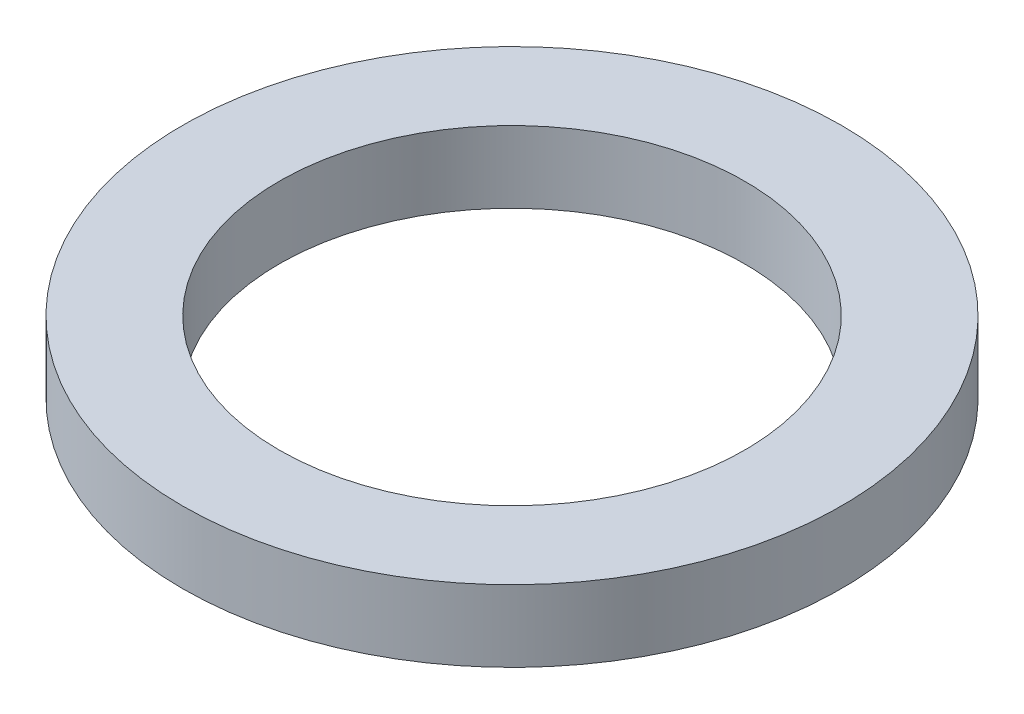
from build123d import *

# Parameters (mm, degrees)
SKETCH1_R           = 29.21
SKETCH1_R_2         = 20.6375
BOSS_EXTRUDE1_DEPTH = 6.35


with BuildPart() as part:
    # Sketch1 → Boss-Extrude1 (new body)
    with BuildSketch(Plane(origin=(0, 0, 0), x_dir=(1, 0, 0), z_dir=(0, 1, 0))):
        with Locations(Location((0, 0, 0), (0, 0, 270))):
            Circle(SKETCH1_R)
        with Locations(Location((0, 0, 0), (0, 0, 270))):
            Circle(SKETCH1_R_2, mode=Mode.SUBTRACT)
    extrude(amount=BOSS_EXTRUDE1_DEPTH)


solid = part.part
